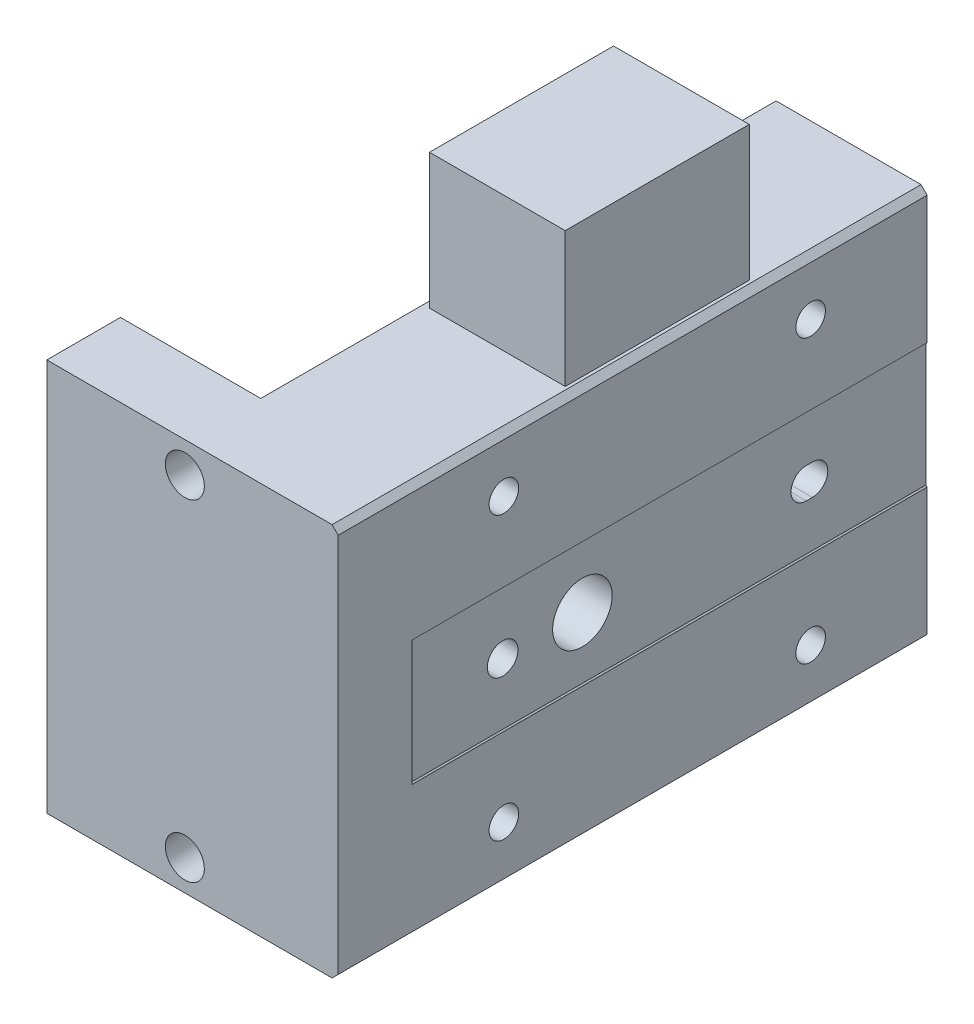
from build123d import *

# Parameters (mm, degrees)
BASE_EXTRUDE_DEPTH               = 12
BOSS_EXTRUDE1_DEPTH              = 84
BOSS_EXTRUDE3_DEPTH              = 12
F_9_7_DIAMETER_HOLE1_D           = 9.7
F_10_32_TAPPED_HOLE1_D           = 4.0386
F_10_32_TAPPED_HOLE1_DEPTH       = 12.8624
F_10_32_TAPPED_HOLE1_CBORE_D     = 4.826
F_10_32_TAPPED_HOLE1_CBORE_DEPTH = 8.9
F_10_32_TAPPED_HOLE1_TIP         = 1.213317848
F_1_4_20_TAPPED_HOLE1_D          = 6.35
F_1_4_20_TAPPED_HOLE1_DEPTH      = 12
CUT_EXTRUDE1_DEPTH               = 5
HOLE1_D                          = 5
HOLE1_DEPTH                      = 5
SKETCH14_W                       = 22.1254
SKETCH14_H                       = 30
BOSS_EXTRUDE2_DEPTH              = 22
CHAMFER1_SIZE                    = 1


with BuildPart() as part:
    # Sketch1 → Base-Extrude (new body)
    with BuildSketch(Plane.XY.offset(-1312.73981158)):
        Polygon((-10.1873, 32), (37.3127, 32), (37.3127, 10.2), (37.1127, 10), (37.1127, -10), (37.3127, -10.2), (37.3127, -32), (-10.1873, -32), align=None)
    extrude(amount=BASE_EXTRUDE_DEPTH)

    # Sketch3 → Boss-Extrude1 (add)
    with BuildSketch(Plane(origin=(0, 0, -1312.73981158), x_dir=(-1, 0, 0), z_dir=(0, 0, -1))):
        Polygon((-37.3127, 10.2), (-37.3127, 32), (-12.6873, 32), (-12.6873, -32), (-37.3127, -32), (-37.3127, -10.2), (-37.1127, -10), (-37.1127, 10), align=None)
    extrude(amount=BOSS_EXTRUDE1_DEPTH)

    # Sketch15 → Boss-Extrude3 (add)
    with BuildSketch(Plane.XY.offset(-1300.73981158)):
        Polygon((37.1127, -10), (37.1127, 10), (37.3127, 10.2), (37.3127, -10.2), align=None)
    extrude(amount=-BOSS_EXTRUDE3_DEPTH)

    # 9.7 Diameter Hole1 (through all)
    with Locations(Plane(origin=(37.1127, 0, 0), x_dir=(0, 0, -1), z_dir=(1, 0, 0))):
        with Locations((1340.73981158, 0)):
            Hole(F_9_7_DIAMETER_HOLE1_D / 2)

    # #10-32 Tapped Hole1
    with Locations(Plane(origin=(37.3127, 0, 0), x_dir=(0, 0, -1), z_dir=(1, 0, 0))):
        with Locations((1327.73981158, 23), (1377.73981158, 23), (1327.73981158, -23), (1377.73981158, -23)):
            CounterBoreHole(F_10_32_TAPPED_HOLE1_D / 2, F_10_32_TAPPED_HOLE1_CBORE_D / 2, F_10_32_TAPPED_HOLE1_CBORE_DEPTH, depth=F_10_32_TAPPED_HOLE1_DEPTH)
            with Locations((0, 0, -(F_10_32_TAPPED_HOLE1_DEPTH + F_10_32_TAPPED_HOLE1_TIP / 2))):  # 118° drill point
                Cone(0, F_10_32_TAPPED_HOLE1_D / 2, F_10_32_TAPPED_HOLE1_TIP, mode=Mode.SUBTRACT)

    # 1/4-20 Tapped Hole1
    with Locations(Plane.XY.offset(-1300.73981158)):
        with Locations((12.3127, 27), (12.3127, -27)):
            Hole(F_1_4_20_TAPPED_HOLE1_D / 2, depth=F_1_4_20_TAPPED_HOLE1_DEPTH)

    # Sketch11 → Cut-Extrude1 (cut)
    with BuildSketch(Plane(origin=(37.1127, 0, 0), x_dir=(0, 0, -1), z_dir=(1, 0, 0))):
        with BuildLine():
            Line((1377.23981158, 2.5), (1378.23981158, 2.5))
            ThreePointArc((1378.23981158, 2.5), (1380.73981158, 0), (1378.23981158, -2.5))
            Line((1378.23981158, -2.5), (1377.23981158, -2.5))
            ThreePointArc((1377.23981158, -2.5), (1374.73981158, 0), (1377.23981158, 2.5))
        make_face()
    extrude(amount=-CUT_EXTRUDE1_DEPTH, mode=Mode.SUBTRACT)

    # Hole1
    with Locations(Plane(origin=(37.1127, 0, 0), x_dir=(0, 0, -1), z_dir=(1, 0, 0))):
        with Locations((1327.73981158, 0)):
            Hole(HOLE1_D / 2, depth=HOLE1_DEPTH)

    # Sketch14 → Boss-Extrude2 (add)
    with BuildSketch(Plane(origin=(0, 32, 0), x_dir=(-1, 0, 0), z_dir=(0, 1, 0))):
        with Locations((-24.75, -1354.23981158)):
            Rectangle(SKETCH14_W, SKETCH14_H)
    extrude(amount=BOSS_EXTRUDE2_DEPTH)

    # Chamfer1
    chamfer1_edges = [part.edges().sort_by_distance(p)[0] for p in [
        (37.3127, -32, -1348.73981158),
        (37.3127, 32, -1348.73981158),
    ]]
    chamfer(chamfer1_edges, length=CHAMFER1_SIZE)


solid = part.part
